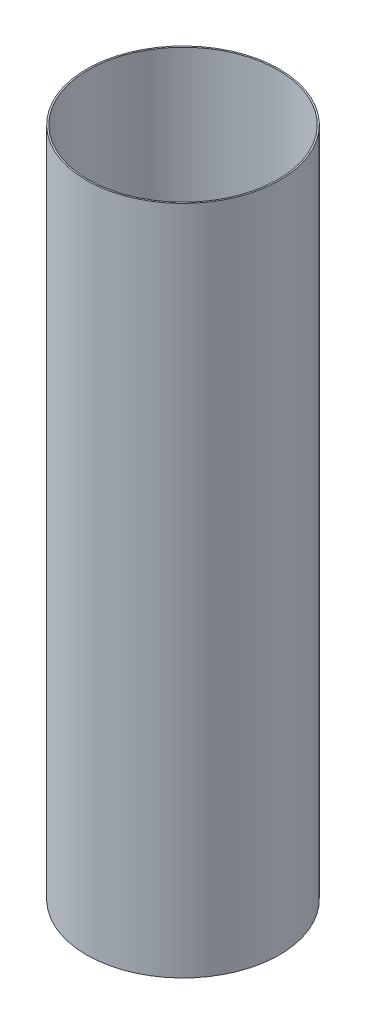
from build123d import *

# Parameters (mm, degrees)
SKETCH1_R           = 65.7225
SKETCH1_R_2         = 64.7065
BOSS_EXTRUDE1_DEPTH = 457.2


with BuildPart() as part:
    # Sketch1 → Boss-Extrude1 (new body)
    with BuildSketch(Plane(origin=(0, 0, 0), x_dir=(1, 0, 0), z_dir=(0, 1, 0))):
        with Locations(Location((0, 0, 0), (0, 0, 270))):
            Circle(SKETCH1_R)
        with Locations(Location((0, 0, 0), (0, 0, 270))):
            Circle(SKETCH1_R_2, mode=Mode.SUBTRACT)
    extrude(amount=BOSS_EXTRUDE1_DEPTH)


solid = part.part
